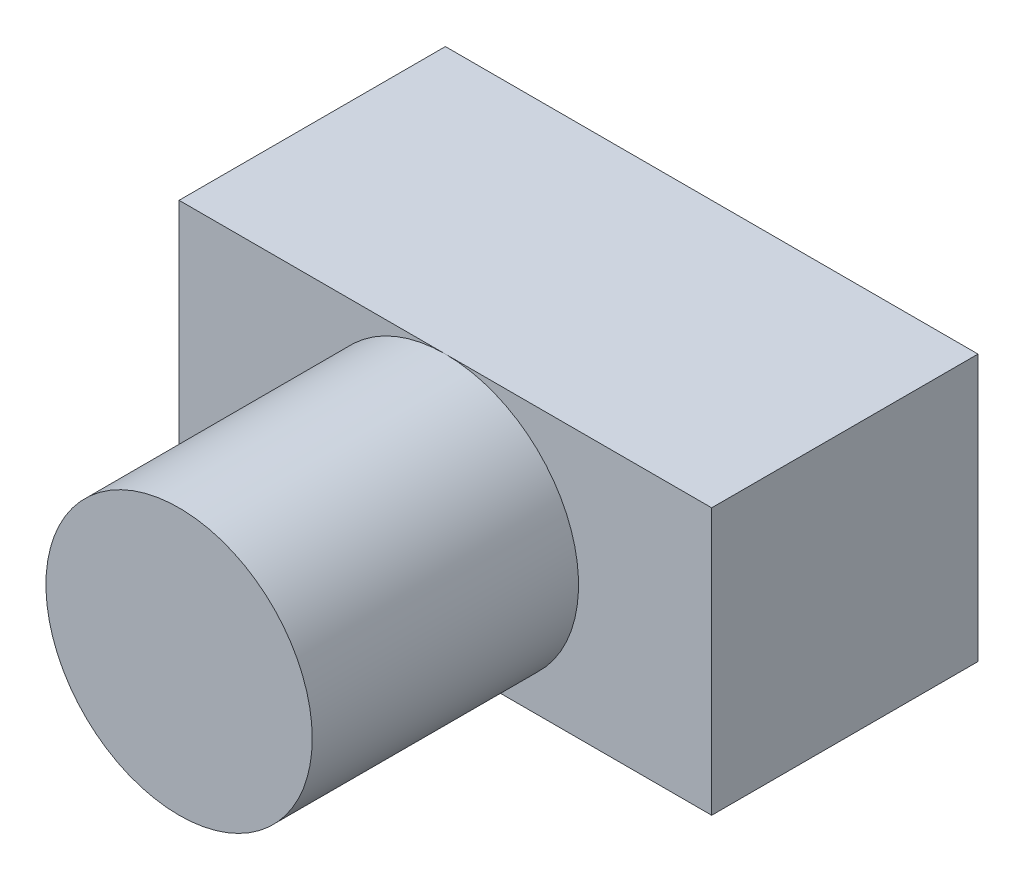
from build123d import *

# Parameters (mm, degrees)
SKETCH1_W           = 10
SKETCH1_H           = 5
BOSS_EXTRUDE1_DEPTH = 5
SKETCH2_R           = 2.5
BOSS_EXTRUDE2_DEPTH = 5


with BuildPart() as part:
    # Sketch1 → Boss-Extrude1 (new body)
    with BuildSketch(Plane.XY):
        with Locations((-5, 2.5)):
            Rectangle(SKETCH1_W, SKETCH1_H)
    extrude(amount=BOSS_EXTRUDE1_DEPTH)

    # Sketch2 → Boss-Extrude2 (add)
    with BuildSketch(Plane.XY.offset(5)):
        with Locations(Location((-5, 2.5, 0), (0, 0, 270))):
            Circle(SKETCH2_R)
    extrude(amount=BOSS_EXTRUDE2_DEPTH)


solid = part.part
